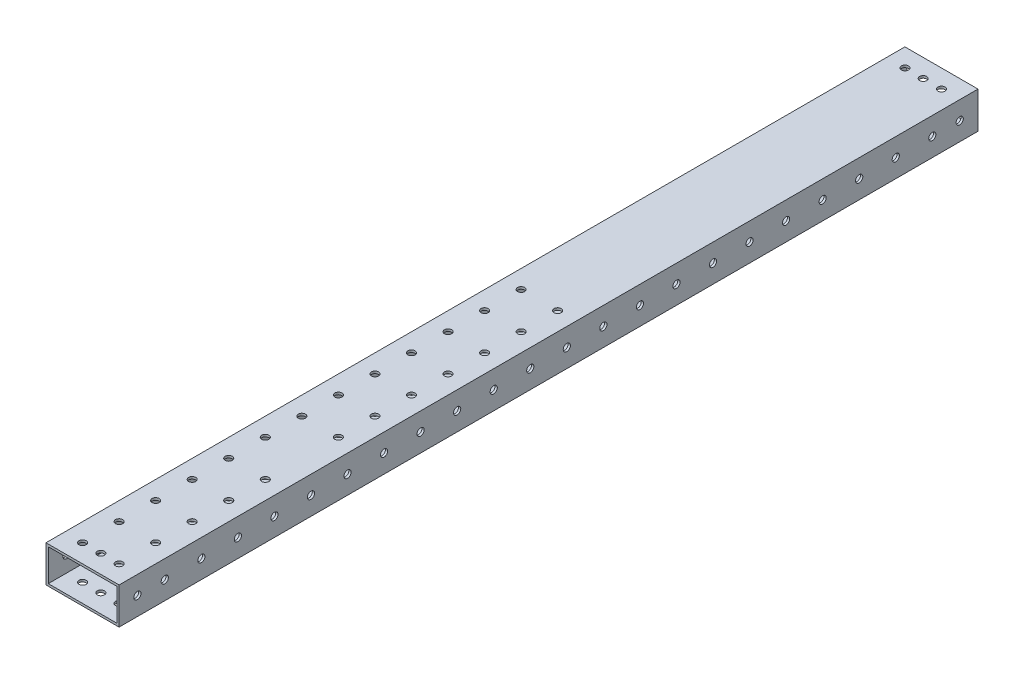
from build123d import *

# Parameters (mm, degrees)
SKETCH1_W           = 50.8
SKETCH1_H           = 25.4
BOSS_EXTRUDE1_DEPTH = 298.45
SHELL1_T            = -1.5875
SKETCH2_R           = 2.4892
CUT_EXTRUDE1_DEPTH  = 304.806192333
SKETCH3_R           = 2.4892
CUT_EXTRUDE2_DEPTH  = 304.806192333
SKETCH4_R           = 2.4892
CUT_EXTRUDE3_DEPTH  = 304.806192333
LPATTERN1_COUNT     = 22
LPATTERN1_PITCH     = 25.4
SKETCH5_R           = 2.4892
CUT_EXTRUDE4_DEPTH  = 304.806192333


with BuildPart() as part:
    # Sketch1 → Boss-Extrude1 (new, symmetric)
    with BuildSketch(Plane.XY):
        with Locations((25.4, 12.7)):
            Rectangle(SKETCH1_W, SKETCH1_H)
    extrude(amount=BOSS_EXTRUDE1_DEPTH, both=True)

    # Shell1
    shell1_openings = [part.faces().sort_by_distance(p)[0] for p in [
        (25.4, 12.7, 298.45),
        (25.4, 12.7, -298.45),
    ]]
    offset(amount=SHELL1_T, openings=shell1_openings, kind=Kind.INTERSECTION)

    # Sketch2 → Cut-Extrude1 (cut, through all)
    with BuildSketch(Plane(origin=(0, 25.4, 0), x_dir=(1, 0, 0), z_dir=(0, 1, 0))):
        with Locations(Location((38.1, -285.75, 0), (0, 0, 270))):
            Circle(SKETCH2_R)
        with Locations(Location((25.4, -285.75, 0), (0, 0, 270))):
            Circle(SKETCH2_R)
        with Locations(Location((12.7, -285.75, 0), (0, 0, 270))):
            Circle(SKETCH2_R)
    cut_extrude1 = extrude(amount=-CUT_EXTRUDE1_DEPTH, mode=Mode.SUBTRACT)

    # Sketch3 → Cut-Extrude2 (cut, through all)
    with BuildSketch(Plane(origin=(50.8, 0, 0), x_dir=(0, 0, -1), z_dir=(1, 0, 0))):
        with Locations((-285.75, 12.7)):
            Circle(SKETCH3_R)
    cut_extrude2 = extrude(amount=-CUT_EXTRUDE2_DEPTH, mode=Mode.SUBTRACT)

    # Mirror1: Cut-Extrude1, Cut-Extrude2 across plane
    add(cut_extrude1.mirror(Plane.XY), mode=Mode.SUBTRACT)
    add(cut_extrude2.mirror(Plane.XY), mode=Mode.SUBTRACT)

    # Sketch4 → Cut-Extrude3 (cut, symmetric)
    with BuildSketch(Plane(origin=(50.8, 0, 0), x_dir=(0, 0, -1), z_dir=(1, 0, 0))):
        with Locations(Location((-266.7, 12.7, 0), (0, 0, 180))):
            Circle(SKETCH4_R)
    cut_extrude3 = extrude(amount=CUT_EXTRUDE3_DEPTH, both=True, mode=Mode.SUBTRACT)

    # LPattern1: Cut-Extrude3 ×22
    with Locations(*[(0, 0, -i * LPATTERN1_PITCH) for i in range(1, LPATTERN1_COUNT)]):
        add(cut_extrude3, mode=Mode.SUBTRACT)

    # Sketch5 → Cut-Extrude4 (cut, through all)
    with BuildSketch(Plane.XZ):
        with Locations(Location((12.7, 158.75, 0), (0, 0, 270))):
            Circle(SKETCH5_R)
        with Locations(Location((12.7, 184.15, 0), (0, 0, 270))):
            Circle(SKETCH5_R)
        with Locations(Location((38.1, 184.15, 0), (0, 0, 270))):
            Circle(SKETCH5_R)
        with Locations(Location((38.1, 209.55, 0), (0, 0, 270))):
            Circle(SKETCH5_R)
        with Locations(Location((12.7, 209.55, 0), (0, 0, 270))):
            Circle(SKETCH5_R)
        with Locations(Location((12.7, 234.95, 0), (0, 0, 270))):
            Circle(SKETCH5_R)
        with Locations(Location((38.1, 234.95, 0), (0, 0, 270))):
            Circle(SKETCH5_R)
        with Locations(Location((38.1, 260.35, 0), (0, 0, 270))):
            Circle(SKETCH5_R)
        with Locations(Location((12.7, 260.35, 0), (0, 0, 270))):
            Circle(SKETCH5_R)
        with Locations(Location((12.7, 31.75, 0), (0, 0, 270))):
            Circle(SKETCH5_R)
        with Locations(Location((38.1, 31.75, 0), (0, 0, 270))):
            Circle(SKETCH5_R)
        with Locations(Location((12.7, 57.15, 0), (0, 0, 270))):
            Circle(SKETCH5_R)
        with Locations(Location((38.1, 57.15, 0), (0, 0, 270))):
            Circle(SKETCH5_R)
        with Locations(Location((12.7, 82.55, 0), (0, 0, 270))):
            Circle(SKETCH5_R)
        with Locations(Location((38.1, 82.55, 0), (0, 0, 270))):
            Circle(SKETCH5_R)
        with Locations(Location((38.1, 107.95, 0), (0, 0, 270))):
            Circle(SKETCH5_R)
        with Locations(Location((38.1, 133.35, 0), (0, 0, 270))):
            Circle(SKETCH5_R)
        with Locations(Location((12.7, 107.95, 0), (0, 0, 270))):
            Circle(SKETCH5_R)
        with Locations(Location((12.7, 133.35, 0), (0, 0, 270))):
            Circle(SKETCH5_R)
        with Locations(Location((38.1, 6.35, 0), (0, 0, 270))):
            Circle(SKETCH5_R)
        with Locations(Location((38.1, -19.05, 0), (0, 0, 270))):
            Circle(SKETCH5_R)
        with Locations(Location((12.7, -19.05, 0), (0, 0, 270))):
            Circle(SKETCH5_R)
        with Locations(Location((12.7, 6.35, 0), (0, 0, 270))):
            Circle(SKETCH5_R)
    extrude(amount=-CUT_EXTRUDE4_DEPTH, mode=Mode.SUBTRACT)


solid = part.part
